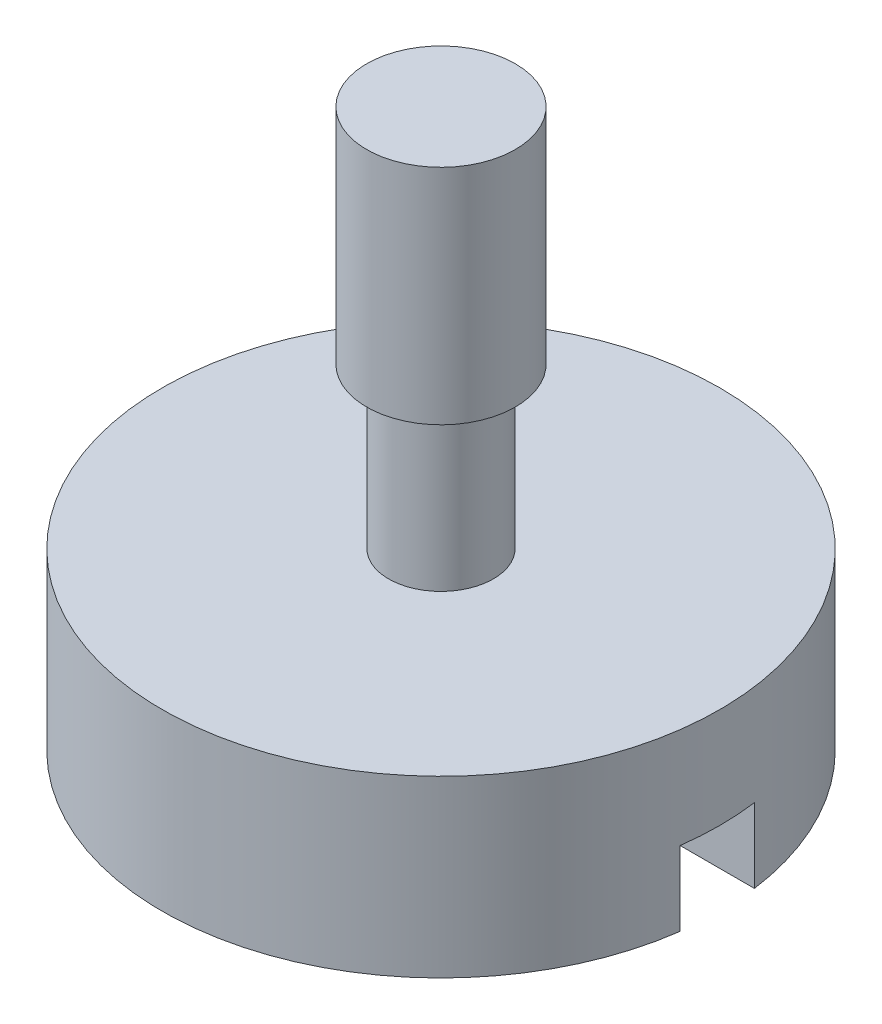
from build123d import *

# Parameters (mm, degrees)
SCHIZZO2_W               = 20.11559051
SCHIZZO2_H               = 2
TAGLIO_ESTRUSIONE1_DEPTH = 2


with BuildPart() as part:
    # Schizzo1 → Rivoluzione1 (revolve)
    with BuildSketch(Plane.XY, mode=Mode.PRIVATE) as rivoluzione1_sk:
        Polygon((0, 15), (2, 15), (2, 9), (1.409533837, 9), (1.409533837, 4.7), (7.5, 4.7), (7.5, 0), (0, 0), align=None)
    revolve(rivoluzione1_sk.sketch.rotate(Axis((0, -3.578292252, 0), (0, 1, 0)), 90), axis=Axis((0, -3.578292252, 0), (0, 1, 0)))

    # Schizzo2 → Taglio-Estrusione1 (cut)
    with BuildSketch(Plane.XZ):
        Rectangle(SCHIZZO2_W, SCHIZZO2_H)
    extrude(amount=-TAGLIO_ESTRUSIONE1_DEPTH, mode=Mode.SUBTRACT)


solid = part.part
